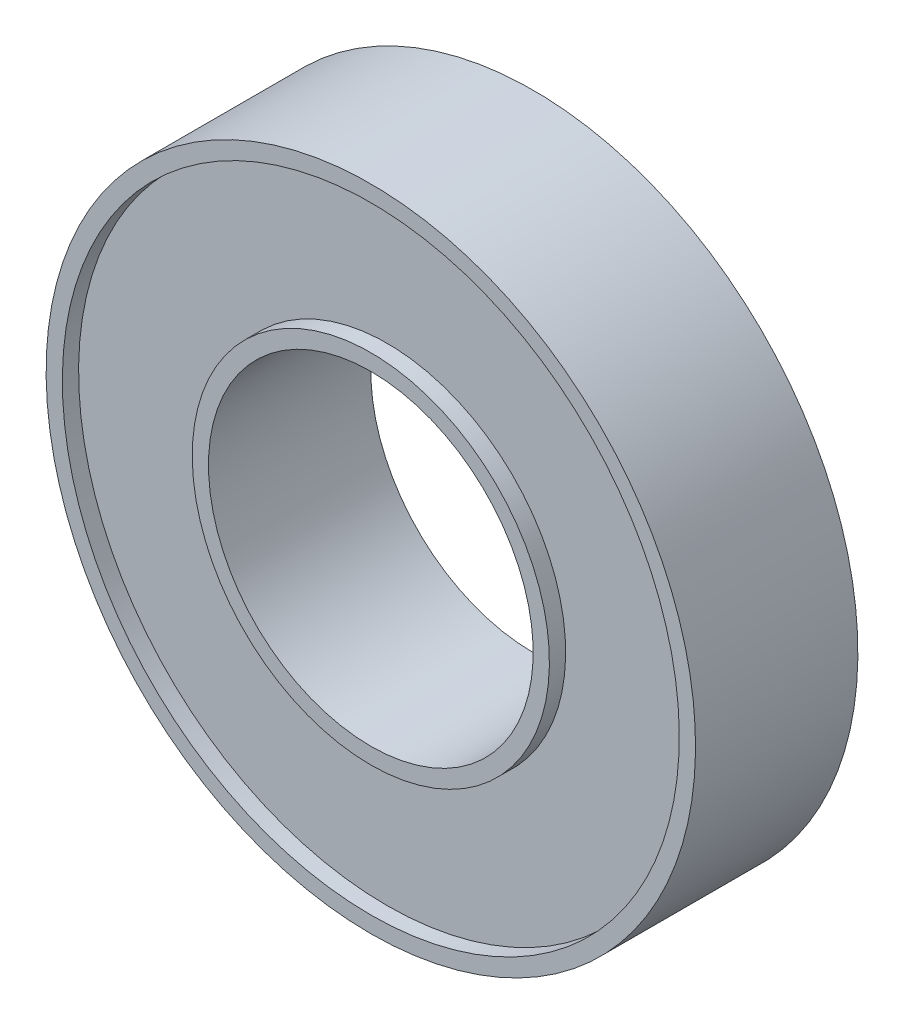
from build123d import *


with BuildPart() as part:
    # Sketch1 → Revolve2 (revolve)
    with BuildSketch(Plane(origin=(0, 0, 0), x_dir=(0, 0, -1), z_dir=(1, 0, 0)), mode=Mode.PRIVATE) as revolve2_sk:
        Polygon((-5, 20), (5, 20), (5, 19), (4, 19), (4, 11), (5, 11), (5, 10), (-5, 10), (-5, 11), (-4, 11), (-4, 19), (-5, 19), align=None)
    revolve(revolve2_sk.sketch.rotate(Axis((0, 0, 5), (0, 0, -1)), 180), axis=Axis((0, 0, 5), (0, 0, -1)))


solid = part.part
